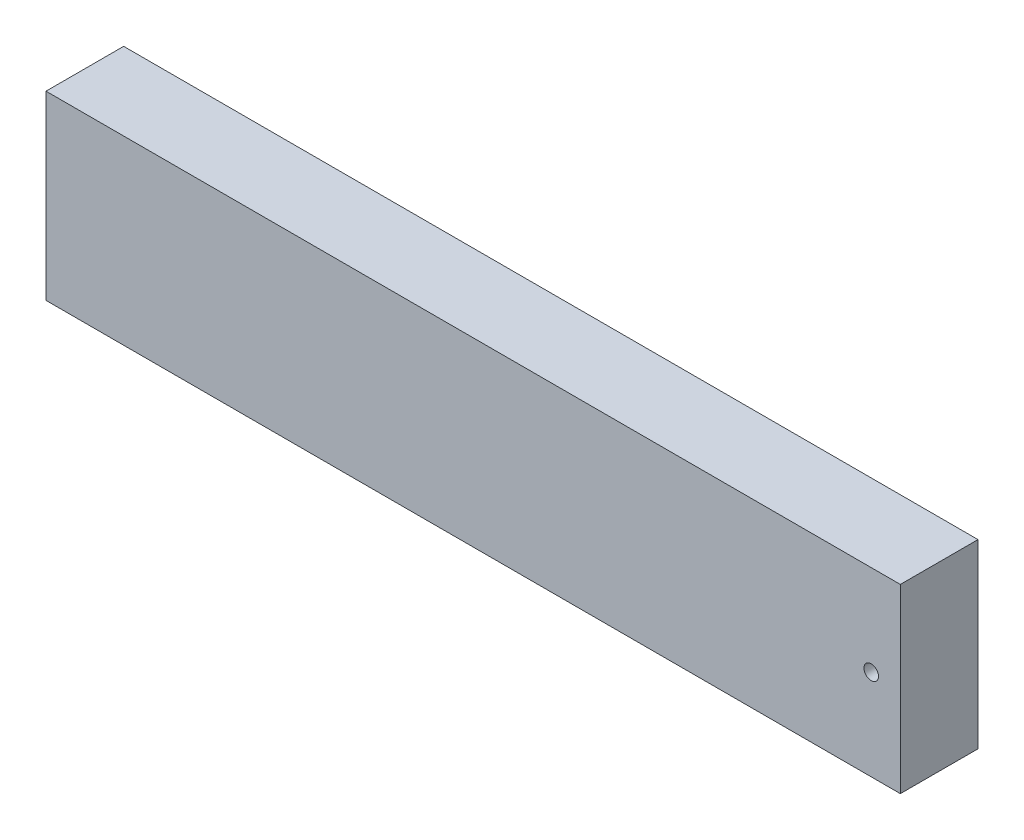
from build123d import *

# Parameters (mm, degrees)
SKETCH1_W                       = 419.1
SKETCH1_H                       = 88.9
BOSS_EXTRUDE1_DEPTH             = 38.1
F_9_32_0_28125_DIAMETER_HOLE1_D = 7.14375


with BuildPart() as part:
    # Sketch1 → Boss-Extrude1 (new body)
    with BuildSketch(Plane.XY):
        with Locations((209.55, 44.45)):
            Rectangle(SKETCH1_W, SKETCH1_H)
    extrude(amount=BOSS_EXTRUDE1_DEPTH)

    # 9/32 (0.28125) Diameter Hole1 (through all)
    with Locations(Plane.XY.offset(38.1)):
        with Locations((404.8125, 44.45)):
            Hole(F_9_32_0_28125_DIAMETER_HOLE1_D / 2)


solid = part.part
